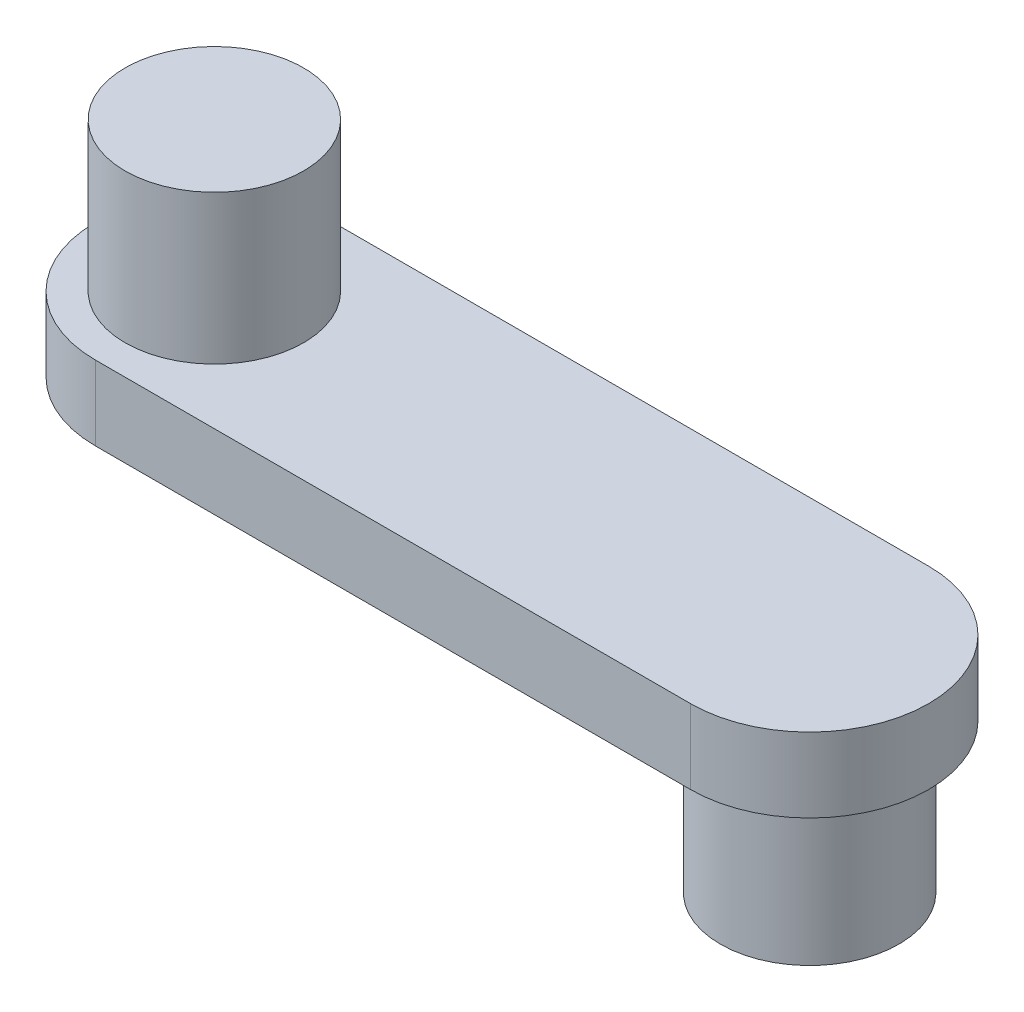
from build123d import *

# Parameters (mm, degrees)
BOSS_EXTRUDE1_DEPTH = 5
SKETCH1_3_R         = 6
BOSS_EXTRUDE2_DEPTH = 15
SKETCH1_4_R         = 6
BOSS_EXTRUDE3_DEPTH = 10


with BuildPart() as part:
    # Sketch1 → Boss-Extrude1 (new body)
    with BuildSketch(Plane(origin=(0, 0, 0), x_dir=(1, 0, 0), z_dir=(0, 1, 0))):
        with BuildLine():
            Line((40, 8), (0, 8))
            ThreePointArc((0, 8), (-8, 0), (0, -8))
            Line((0, -8), (40, -8))
            ThreePointArc((40, -8), (48, 0), (40, 8))
        make_face()
    extrude(amount=BOSS_EXTRUDE1_DEPTH)

    # Sketch1<3> → Boss-Extrude2 (add)
    with BuildSketch(Plane(origin=(0, 0, 0), x_dir=(1, 0, 0), z_dir=(0, 1, 0))):
        Circle(SKETCH1_3_R)
    extrude(amount=BOSS_EXTRUDE2_DEPTH)

    # Sketch1<4> → Boss-Extrude3 (add)
    with BuildSketch(Plane(origin=(0, 0, 0), x_dir=(1, 0, 0), z_dir=(0, 1, 0))):
        with Locations((40, 0)):
            Circle(SKETCH1_4_R)
    extrude(amount=-BOSS_EXTRUDE3_DEPTH)


solid = part.part
